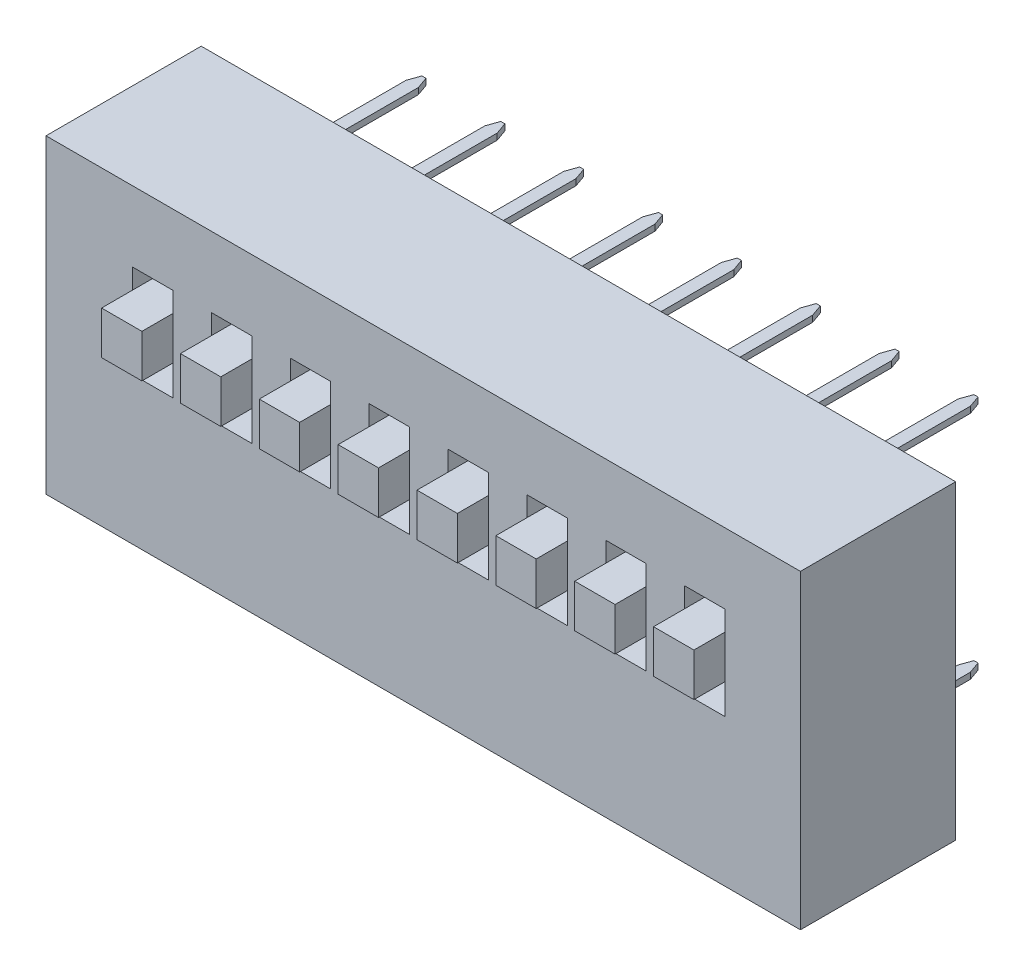
from build123d import *

# Parameters (mm, degrees)
SKETCH1_W              = 24.3
SKETCH1_H              = 10
BOSS_EXTRUDE1_DEPTH    = 5
SKETCH2_W              = 1.3
SKETCH2_H              = 3
CUT_EXTRUDE3_DEPTH     = 1
LPATTERN1_COUNT        = 8
LPATTERN1_PITCH        = 2.54
SKETCH3_W              = 1.3
SKETCH3_H              = 1.384019907
BOSS_EXTRUDE2_DEPTH    = 2
LPATTERN2_COUNT        = 8
LPATTERN2_PITCH        = 2.54
BOSS_EXTRUDE3_DEPTH    = 0.2
LPATTERN3_COUNT        = 8
LPATTERN3_PITCH        = 2.54
LPATTERN5_COPY_1_DEPTH = 0.2
LPATTERN5_COPY_2_DEPTH = 0.2


with BuildPart() as part:
    # Sketch1 → Boss-Extrude1 (new body)
    with BuildSketch(Plane.XY):
        Rectangle(SKETCH1_W, SKETCH1_H)
    extrude(amount=BOSS_EXTRUDE1_DEPTH)

    # Sketch2 → Cut-Extrude3 (cut)
    with BuildSketch(Plane.XY.offset(5)):
        with Locations((-8.710298424, 1.233093176)):
            Rectangle(SKETCH2_W, SKETCH2_H)
    cut_extrude3 = extrude(amount=-CUT_EXTRUDE3_DEPTH, mode=Mode.SUBTRACT)

    # LPattern1: Cut-Extrude3 ×8
    with Locations(*[(i * LPATTERN1_PITCH, 0, 0) for i in range(1, LPATTERN1_COUNT)]):
        add(cut_extrude3, mode=Mode.SUBTRACT)

    # Sketch3 → Boss-Extrude2 (add)
    with BuildSketch(Plane.XY.offset(4)):
        with Locations((-8.710298424, 1.39842675)):
            Rectangle(SKETCH3_W, SKETCH3_H)
    boss_extrude2 = extrude(amount=BOSS_EXTRUDE2_DEPTH)

    # LPattern2: Boss-Extrude2 ×8
    with Locations(*[(i * LPATTERN2_PITCH, 0, 0) for i in range(1, LPATTERN2_COUNT)]):
        add(boss_extrude2)


with BuildPart() as part_1:
    # Body-Move/Copy1: moved
    add(part.part.moved(Location((0, 0, 0.9))))

    # Sketch4 → Boss-Extrude3 (add)
    with BuildSketch(Plane(origin=(0, 3.81, 0), x_dir=(1, 0, 0), z_dir=(0, 1, 0))):
        Polygon((-9.39, -0.9), (-9.39, 0), (-9.09, 0), (-9.09, 2.634314575), (-8.955683901, 3.014217874), (-8.824316099, 3.014217874), (-8.69, 2.634314575), (-8.69, 0), (-8.39, 0), (-8.39, -0.9), align=None)
    boss_extrude3 = extrude(amount=-BOSS_EXTRUDE3_DEPTH)

    # LPattern3: Boss-Extrude3 ×8
    with Locations(*[(i * LPATTERN3_PITCH, 0, 0) for i in range(1, LPATTERN3_COUNT)]):
        add(boss_extrude3)

    # Mirror1: Boss-Extrude3 across plane
    add(boss_extrude3.mirror(Plane.ZX))

    # LPattern5 copy 1 sketch → LPattern5 copy 1 (add)
    with BuildSketch(Plane(origin=(17.78, -3.81, 0), x_dir=(1, 0, 0), z_dir=(0, -1, 0))):
        Polygon((-9.39, 0.9), (-9.39, 0), (-9.09, 0), (-9.09, -2.634314575), (-8.955683901, -3.014217874), (-8.824316099, -3.014217874), (-8.69, -2.634314575), (-8.69, 0), (-8.39, 0), (-8.39, 0.9), align=None)
    extrude(amount=-LPATTERN5_COPY_1_DEPTH)

    # LPattern5 copy 2 sketch → LPattern5 copy 2 (add)
    with BuildSketch(Plane(origin=(17.78, 3.81, 0), x_dir=(1, 0, 0), z_dir=(0, 1, 0))):
        Polygon((-9.39, -0.9), (-9.39, 0), (-9.09, 0), (-9.09, 2.634314575), (-8.955683901, 3.014217874), (-8.824316099, 3.014217874), (-8.69, 2.634314575), (-8.69, 0), (-8.39, 0), (-8.39, -0.9), align=None)
    extrude(amount=-LPATTERN5_COPY_2_DEPTH)


solid = part_1.part
